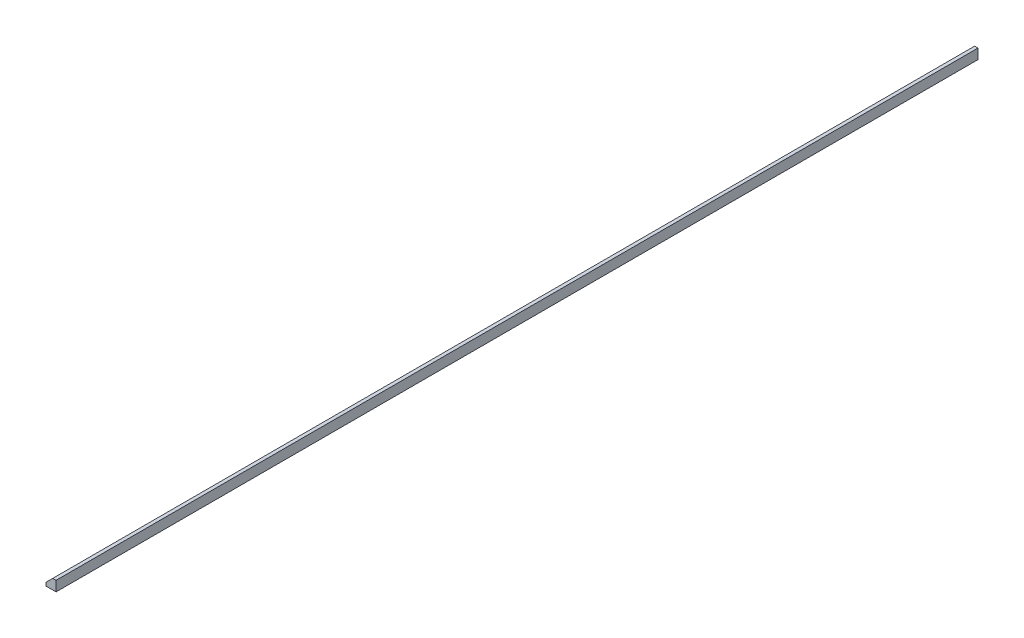
from build123d import *

# Parameters (mm, degrees)
ESQUISSE1_W        = 12
ESQUISSE1_H        = 12
BOSS_EXTRU_1_DEPTH = 1100
CHANFREIN1_SIZE    = 8


with BuildPart() as part:
    # Esquisse1 → Boss.-Extru.1 (new body)
    with BuildSketch(Plane.XY):
        with Locations((6, 6)):
            Rectangle(ESQUISSE1_W, ESQUISSE1_H)
    extrude(amount=BOSS_EXTRU_1_DEPTH)

    # Chanfrein1
    chanfrein1_edges = [part.edges().sort_by_distance(p)[0] for p in [
        (0, 12, 550),
    ]]
    chamfer(chanfrein1_edges, length=CHANFREIN1_SIZE)


solid = part.part
